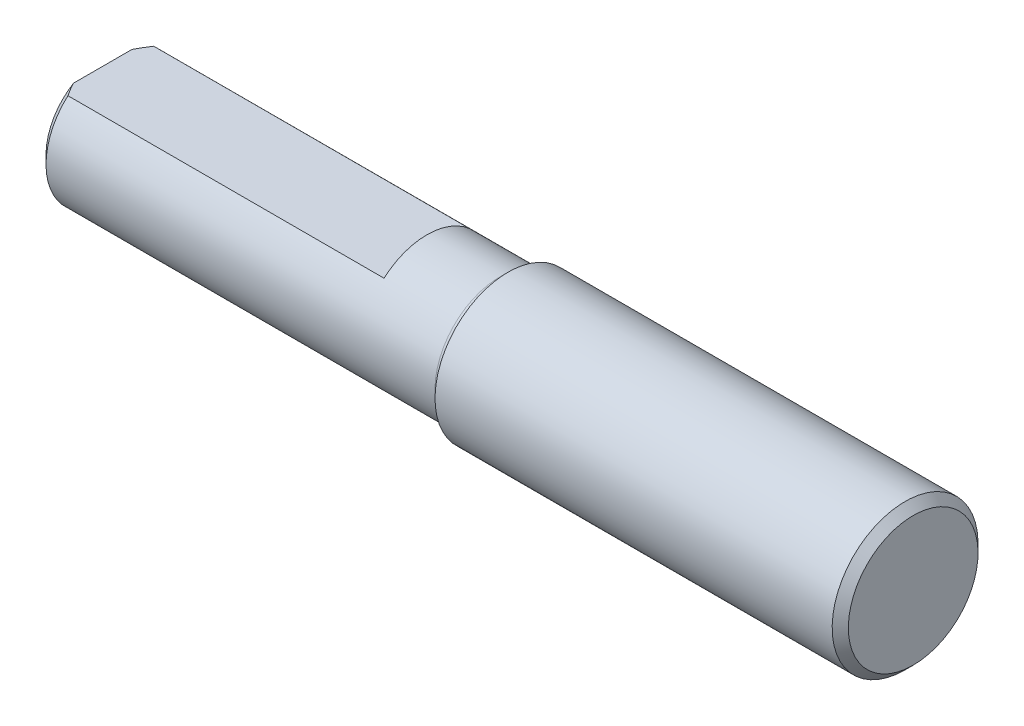
from build123d import *

# Parameters (mm, degrees)
CUT_EXTRUDE_1_DEPTH = 20


with BuildPart() as part:
    # 草图1 → 旋转1 (revolve)
    with BuildSketch(Plane.XY, mode=Mode.PRIVATE) as revolve_1_sk:
        with BuildLine():
            Line((25, 0), (25, 4))
            Line((25, 4), (24.5, 4.5))
            Line((24.5, 4.5), (0, 4.5))
            ThreePointArc((0, 4.5), (-0.146446609, 4.146446609), (-0.5, 4))
            Line((-0.5, 4), (-24.5, 4))
            Line((-24.5, 4), (-25, 3.5))
            Line((-25, 3.5), (-25, 0))
            Line((-25, 0), (25, 0))
        make_face()
    revolve(revolve_1_sk.sketch.rotate(Axis((-25, 0, 0), (1, 0, 0)), 180), axis=Axis((-25, 0, 0), (1, 0, 0)))

    # 草图2 → 切除-拉伸1 (cut)
    with BuildSketch(Plane.ZY.offset(25)):
        with BuildLine():
            Line((-2.645751311, 3), (2.645751311, 3))
            ThreePointArc((2.645751311, 3), (0, 4), (-2.645751311, 3))
        make_face()
    extrude(amount=-CUT_EXTRUDE_1_DEPTH, mode=Mode.SUBTRACT)


solid = part.part
